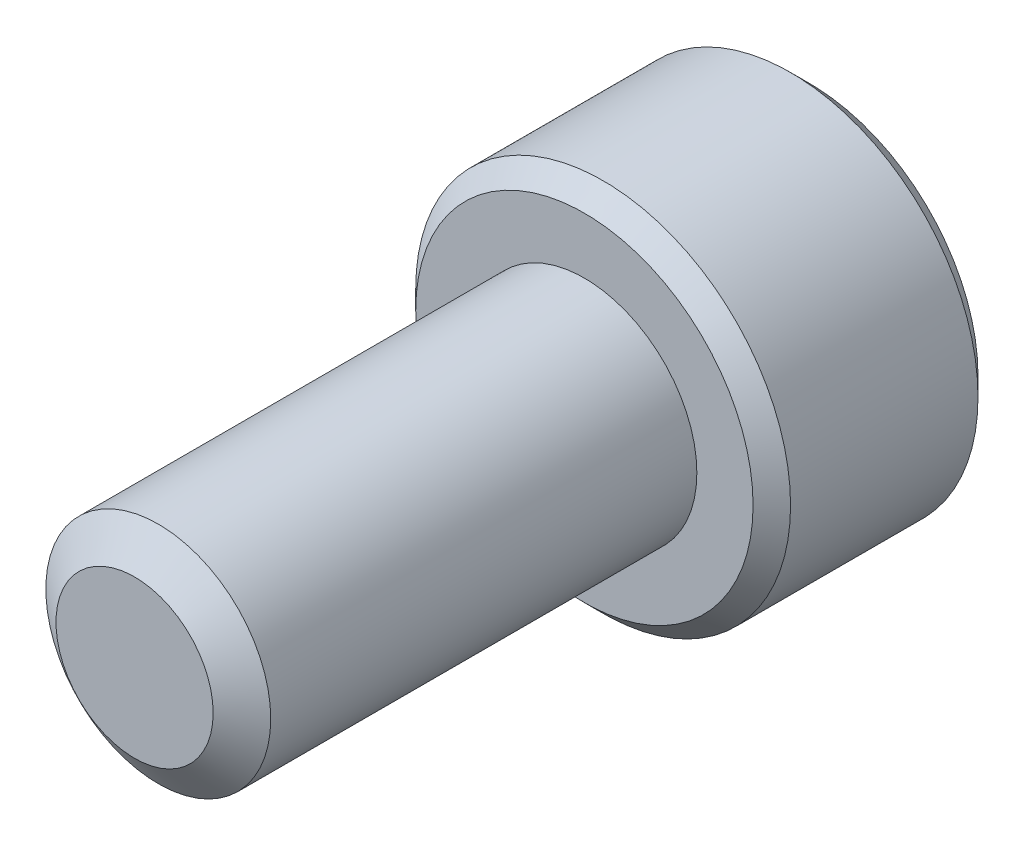
from build123d import *

# Parameters (mm, degrees)
SKETCH1_R          = 3
EXTRUDE1_DEPTH     = 12
SKETCH6_R          = 5
EXTRUDE2_DEPTH     = 6
CUT_EXTRUDE1_DEPTH = 3.75
CHAMFER1_SIZE      = 0.5


with BuildPart() as part:
    # Sketch1 → Extrude1 (new body)
    with BuildSketch(Plane.XY):
        Circle(SKETCH1_R)
    extrude(amount=-EXTRUDE1_DEPTH)

    # Sketch4 → Cut-Revolve1 (revolve, cut)
    with BuildSketch(Plane(origin=(0, 0, 0), x_dir=(0, 0, -1), z_dir=(1, 0, 0))):
        Polygon((0.632650852, 3), (0, 2.096480947), (0, 3), align=None)
    revolve(axis=Axis((0, 0, 0), (0, 0, -1)), mode=Mode.SUBTRACT)

    # Sketch6 → Extrude2 (add)
    with BuildSketch(Plane(origin=(0, 0, -12), x_dir=(-1, 0, 0), z_dir=(0, 0, -1))):
        Circle(SKETCH6_R)
    extrude(amount=EXTRUDE2_DEPTH)

    # Sketch7 → Cut-Extrude1 (cut)
    with BuildSketch(Plane(origin=(0, 0, -18), x_dir=(-1, 0, 0), z_dir=(0, 0, -1))):
        Polygon((0, 2.886751346), (-2.5, 1.443375673), (-2.5, -1.443375673), (0, -2.886751346), (2.5, -1.443375673), (2.5, 1.443375673), align=None)
    extrude(amount=-CUT_EXTRUDE1_DEPTH, mode=Mode.SUBTRACT)

    # Chamfer1
    chamfer1_edges = [part.edges().sort_by_distance(p)[0] for p in [
        (5, 0, -18),
        (5, 0, -12),
    ]]
    chamfer(chamfer1_edges, length=CHAMFER1_SIZE)


solid = part.part
